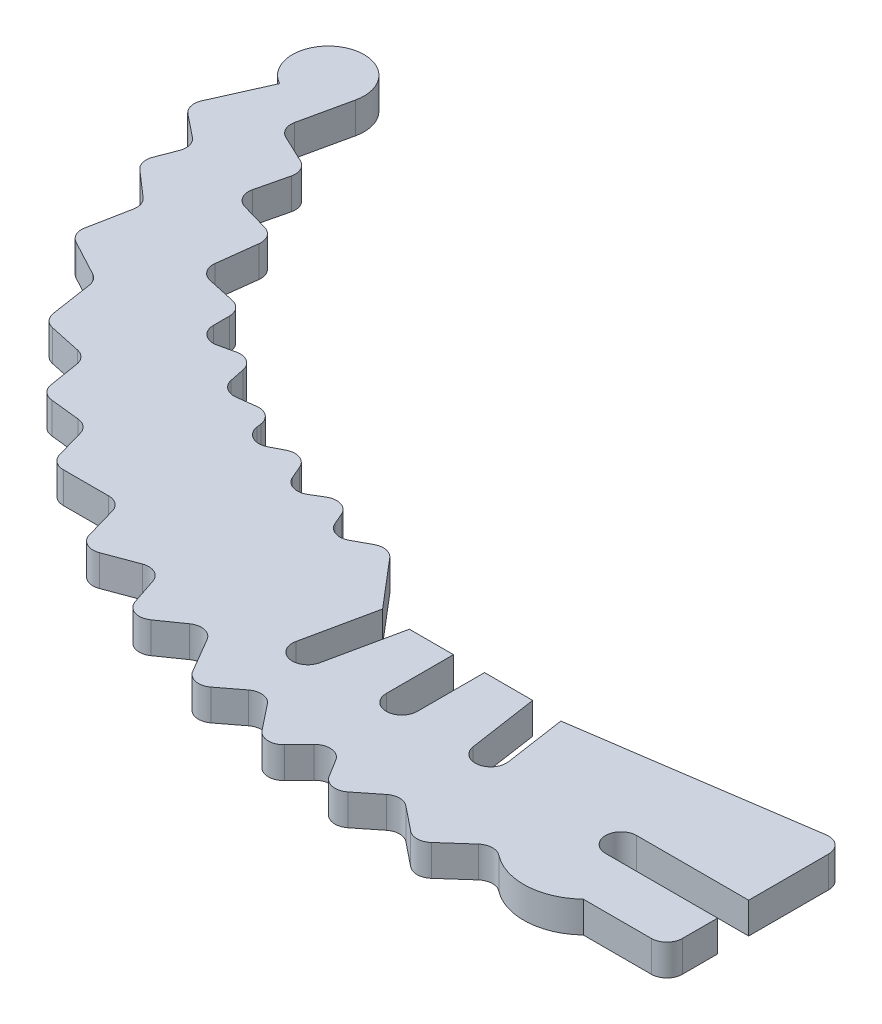
from build123d import *

# Parameters (mm, degrees)
BOSS_EXTRUDE1_DEPTH = 3
FILLET1_R           = 1.5


with BuildPart() as part:
    # Sketch1 → Boss-Extrude1 (new body)
    with BuildSketch(Plane(origin=(0, 0, 0), x_dir=(1, 0, 0), z_dir=(0, 1, 0))):
        with BuildLine():
            Line((0, 0), (0, -4.9))
            Line((0, -4.9), (-8.07, -4.9))
            ThreePointArc((-8.07, -4.9), (-12.492074003, -6.540978064), (-16.72, -4.45))
            Line((-16.72, -4.45), (-21.1, -8.34))
            Line((-21.1, -8.34), (-25.391000021, -4.9))
            Line((-25.391000021, -4.9), (-29.72, -8.34))
            Line((-29.72, -8.34), (-32.678148271, -3.564930925))
            Line((-32.678148271, -3.564930925), (-36.614261147, -7.659439528))
            Line((-36.614261147, -7.659439528), (-40.562742989, -2.671583593))
            Line((-40.562742989, -2.671583593), (-45.125314278, -6.1674487))
            Line((-45.125314278, -6.1674487), (-48.772662965, 0.055817603))
            Line((-48.772662965, 0.055817603), (-53.951591598, -3.564930925))
            Line((-53.951591598, -3.564930925), (-55.938419332, 2.377817283))
            Line((-55.938419332, 2.377817283), (-61.936703958, 0.149885503))
            Line((-61.936703958, 0.149885503), (-63.582832138, 5.91))
            Line((-63.582832138, 5.91), (-70.22, 5.91))
            Line((-70.22, 5.91), (-71.604933744, 10.75614566))
            Line((-71.604933744, 10.75614566), (-76.607483243, 11.297362631))
            Line((-76.607483243, 11.297362631), (-77.433672711, 16.398034852))
            Line((-77.433672711, 16.398034852), (-82.492501507, 17.477107174))
            Line((-82.492501507, 17.477107174), (-83.382855617, 23.343000893))
            Line((-83.382855617, 23.343000893), (-88.482100064, 26.076459388))
            Line((-88.482100064, 26.076459388), (-87.341224149, 31.951970353))
            Line((-87.341224149, 31.951970353), (-91.277246058, 35.3745981))
            Line((-91.277246058, 35.3745981), (-89.794107367, 39.253576213))
            Line((-89.794107367, 39.253576213), (-93.730129276, 42.390984981))
            Line((-93.730129276, 42.390984981), (-90.94122884, 48.642955937))
            ThreePointArc((-90.94122884, 48.642955937), (-90.725239113, 54.836582666), (-85.903522924, 50.94316301))
            Line((-85.903522924, 50.94316301), (-87.217276284, 44.958621486))
            Line((-87.217276284, 44.958621486), (-82.368553642, 42.665402728))
            Line((-82.368553642, 42.665402728), (-83.70912889, 37.071165861))
            Line((-83.70912889, 37.071165861), (-78.394556731, 35.535845015))
            Line((-78.394556731, 35.535845015), (-79.175897543, 29.124170033))
            Line((-79.175897543, 29.124170033), (-73.918336593, 27.970006705))
            Line((-73.918336593, 27.970006705), (-73.918336593, 23.343000893))
            Line((-73.918336593, 23.343000893), (-69.072893301, 24.443370455))
            Line((-69.072893301, 24.443370455), (-68.193719482, 20.137924483))
            Line((-68.193719482, 20.137924483), (-63.570641565, 20.736646715))
            Line((-63.570641565, 20.736646715), (-63.025832704, 16.726559775))
            Line((-63.025832704, 16.726559775), (-58.539054065, 19.028863157))
            Line((-58.539054065, 19.028863157), (-56.712577987, 14.764331957))
            Line((-56.712577987, 14.764331957), (-52.617493847, 17.195788166))
            Line((-52.617493847, 17.195788166), (-50.838197485, 13.029757816))
            Line((-50.838197485, 13.029757816), (-46.752937471, 15.232009778))
            Line((-46.752937471, 15.232009778), (-42.029094435, 9.68))
            Line((-42.029094435, 9.68), (-43.497257011, 2.76895697))
            ThreePointArc((-43.497257011, 2.76895697), (-42.341699959, 0.99), (-40.562742989, 2.145557051))
            Line((-40.562742989, 2.145557051), (-39.047121962, 9.28))
            Line((-39.047121962, 9.28), (-34.787121962, 9.28))
            Line((-34.787121962, 9.28), (-34.787121962, 2.79))
            ThreePointArc((-34.787121962, 2.79), (-33.287121962, 1.29), (-31.787121962, 2.79))
            Line((-31.787121962, 2.79), (-31.787121962, 9.28))
            Line((-31.787121962, 9.28), (-27.137121962, 9.28))
            Line((-27.137121962, 9.28), (-26.141480642, 2.534880632))
            ThreePointArc((-26.141480642, 2.534880632), (-24.438519401, 1.27), (-23.173638769, 2.972961241))
            Line((-23.173638769, 2.972961241), (-24.05, 8.91))
            Line((-24.05, 8.91), (0, 12.46))
            Line((0, 12.46), (0, 3))
            Line((0, 3), (-10.82, 3))
            ThreePointArc((-10.82, 3), (-12.32, 1.5), (-10.82, 0))
            Line((-10.82, 0), (0, 0))
        make_face()
    extrude(amount=BOSS_EXTRUDE1_DEPTH)

    # Fillet1
    fillet1_edges = [part.edges().sort_by_distance(p)[0] for p in [
        (-40.562742989, 1.5, 2.671583593),
        (-45.125314278, 1.5, 6.1674487),
        (-48.772662965, 1.5, -0.055817603),
        (-53.951591598, 1.5, 3.564930925),
        (-55.938419332, 1.5, -2.377817283),
        (-61.936703958, 1.5, -0.149885503),
        (-63.582832138, 1.5, -5.91),
        (-70.22, 1.5, -5.91),
        (-71.604933744, 1.5, -10.75614566),
        (-76.607483243, 1.5, -11.297362631),
        (-77.433672711, 1.5, -16.398034852),
        (-82.492501507, 1.5, -17.477107174),
        (-83.382855617, 1.5, -23.343000893),
        (-88.482100064, 1.5, -26.076459388),
        (-87.341224149, 1.5, -31.951970353),
        (-91.277246058, 1.5, -35.3745981),
        (-89.794107367, 1.5, -39.253576213),
        (-93.730129276, 1.5, -42.390984981),
        (-87.217276284, 1.5, -44.958621486),
        (-82.368553642, 1.5, -42.665402728),
        (-83.70912889, 1.5, -37.071165861),
        (-78.394556731, 1.5, -35.535845015),
        (-79.175897543, 1.5, -29.124170033),
        (-73.918336593, 1.5, -27.970006705),
        (-73.918336593, 1.5, -23.343000893),
        (-69.072893301, 1.5, -24.443370455),
        (-68.193719482, 1.5, -20.137924483),
        (-63.570641565, 1.5, -20.736646715),
        (-63.025832704, 1.5, -16.726559775),
        (-58.539054065, 1.5, -19.028863157),
        (-56.712577987, 1.5, -14.764331957),
        (-52.617493847, 1.5, -17.195788166),
        (-50.838197485, 1.5, -13.029757816),
        (-46.752937471, 1.5, -15.232009778),
        (0, 1.5, -12.46),
        (0, 1.5, 4.9),
        (-16.72, 1.5, 4.45),
        (-21.1, 1.5, 8.34),
        (-25.391000021, 1.5, 4.9),
        (-29.72, 1.5, 8.34),
        (-32.678148271, 1.5, 3.564930925),
        (-36.614261147, 1.5, 7.659439528),
    ]]
    fillet(fillet1_edges, radius=FILLET1_R)


solid = part.part
